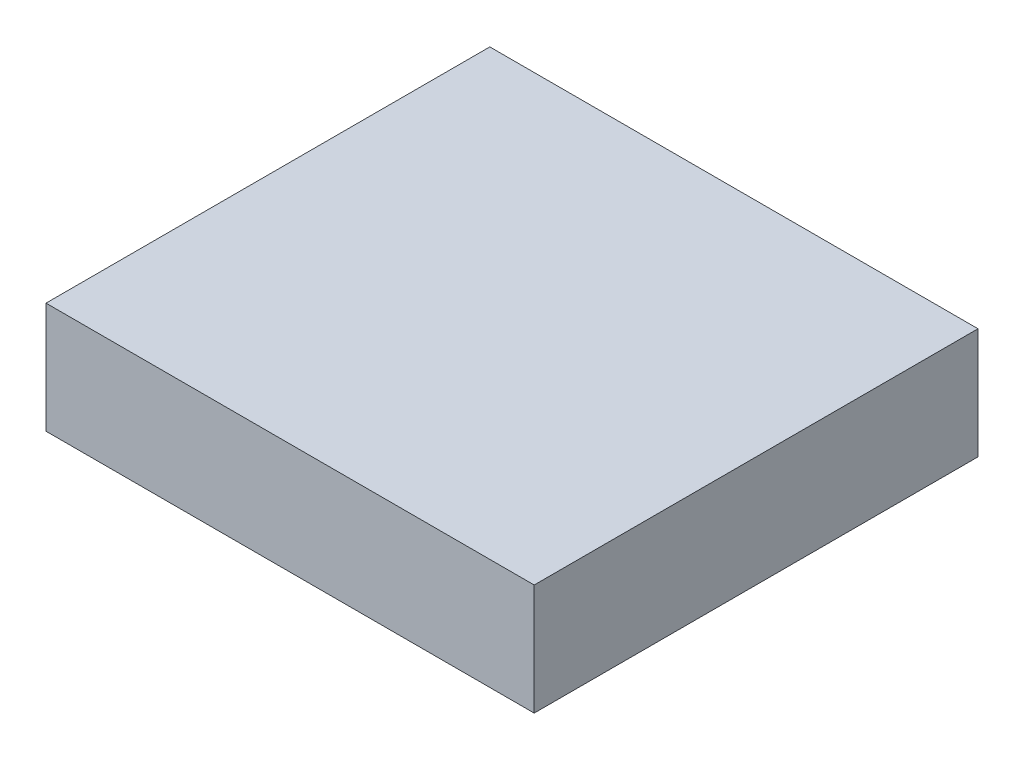
from build123d import *

# Parameters (mm, degrees)
SKETCH1_W           = 110
SKETCH1_H           = 100
BOSS_EXTRUDE1_DEPTH = 25


with BuildPart() as part:
    # Sketch1 → Boss-Extrude1 (new body)
    with BuildSketch(Plane(origin=(0, 0, 0), x_dir=(1, 0, 0), z_dir=(0, 1, 0))):
        Rectangle(SKETCH1_W, SKETCH1_H)
    extrude(amount=BOSS_EXTRUDE1_DEPTH)


solid = part.part
